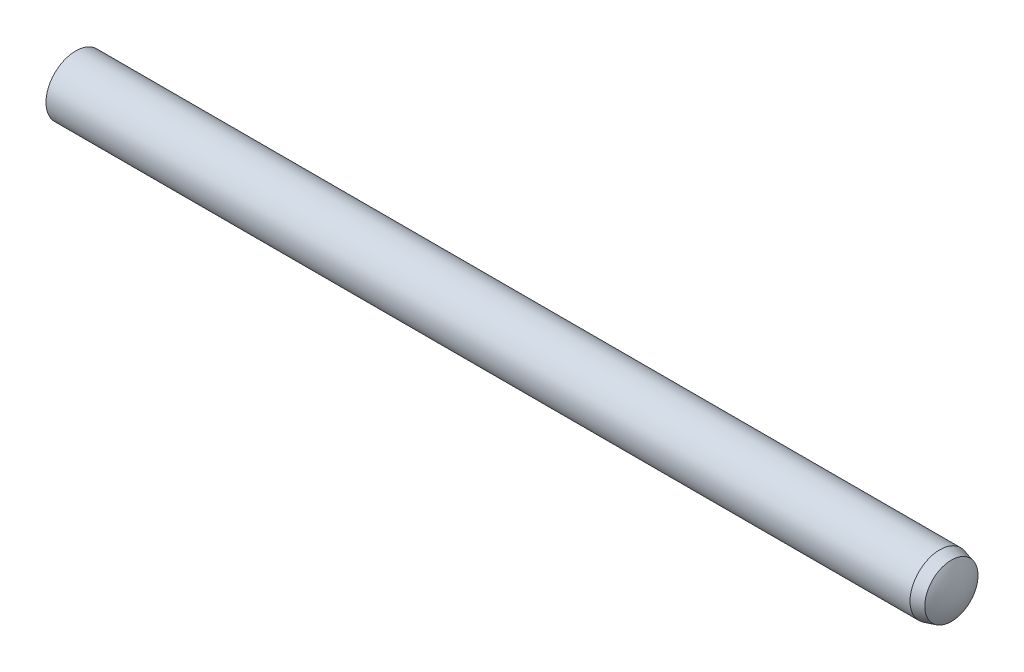
from build123d import *

# Parameters (mm, degrees)
EXTRUDE1_DEPTH      = 22.5
EXTRUDE1_DEPTH_BACK = 22.5
SKETCH2_R           = 1.5


with BuildPart() as part:
    # Sketch2 → Extrude1 (new, two sides: drawn at the far end of the back side and taken through both)
    with BuildSketch(Plane(origin=(0, 0, 0), x_dir=(0, 0, -1), z_dir=(1, 0, 0)).offset(-EXTRUDE1_DEPTH_BACK)):
        Circle(SKETCH2_R)
    extrude(amount=EXTRUDE1_DEPTH + EXTRUDE1_DEPTH_BACK)

    # Sketch5 → Cut-Revolve1 (revolve, cut)
    with BuildSketch(Plane.XY, mode=Mode.PRIVATE) as cut_revolve1_sk:
        with BuildLine():
            Line((21.525, 1.5), (21.525, 2))
            Line((21.525, 2), (23, 2))
            Line((23, 2), (23, 0))
            Line((23, 0), (22.5, 0))
            ThreePointArc((22.5, 0), (22.40052754, 0.699360389), (22.11, 1.343249722))
            Line((22.11, 1.343249722), (21.525, 1.5))
        make_face()
        with BuildLine():
            Line((-22.05, 1.5), (-22.05, 2))
            Line((-22.05, 2), (-23, 2))
            Line((-23, 2), (-23, 0))
            Line((-23, 0), (-22.5, 0))
            ThreePointArc((-22.5, 0), (-22.385076627, 0.783022988), (-22.05, 1.5))
        make_face()
    revolve(cut_revolve1_sk.sketch.rotate(Axis((-22.5, 0, 0), (1, 0, 0)), 270), axis=Axis((-22.5, 0, 0), (1, 0, 0)), mode=Mode.SUBTRACT)


solid = part.part
